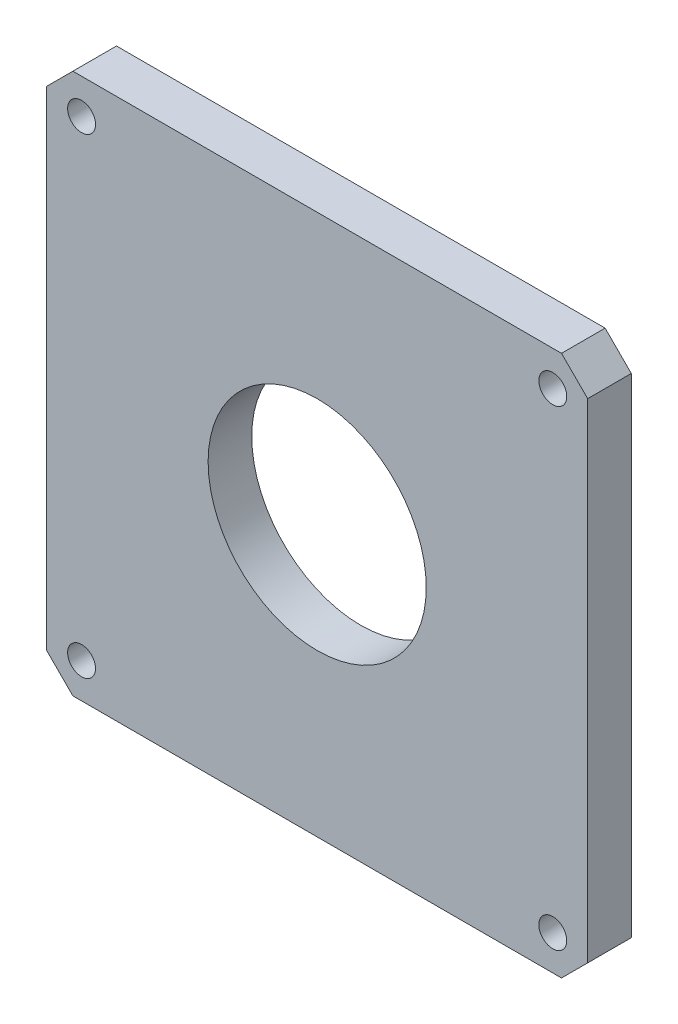
from build123d import *

# Parameters (mm, degrees)
SKETCH_1_W          = 62
SKETCH_1_H          = 62
SKETCH_1_R          = 12.5
EXTRUDE_1_DEPTH     = 5
CHAMFER_1_SIZE      = 3
SKETCH_2_R          = 1.6
CUT_EXTRUDE_1_DEPTH = 45.124822946


with BuildPart() as part:
    # ｽｹｯﾁ1 → ﾎﾞｽ - 押し出し1 (new body)
    with BuildSketch(Plane.XY):
        Rectangle(SKETCH_1_W, SKETCH_1_H)
        Circle(SKETCH_1_R, mode=Mode.SUBTRACT)
    extrude(amount=EXTRUDE_1_DEPTH)

    # 面取り1
    chamfer_1_edges = [part.edges().sort_by_distance(p)[0] for p in [
        (-31, 31, 2.5),
        (31, 31, 2.5),
        (31, -31, 2.5),
        (-31, -31, 2.5),
    ]]
    chamfer(chamfer_1_edges, length=CHAMFER_1_SIZE)

    # ｽｹｯﾁ2 → ｶｯﾄ - 押し出し1 (cut, through all)
    with BuildSketch(Plane.XY.offset(5)):
        with Locations((27, 27)):
            Circle(SKETCH_2_R)
        with Locations(Location((-27, 27, 0), (0, 0, 180))):
            Circle(SKETCH_2_R)
        with Locations(Location((27, -27, 0), (0, 0, 180))):
            Circle(SKETCH_2_R)
        with Locations((-27, -27)):
            Circle(SKETCH_2_R)
    extrude(amount=-CUT_EXTRUDE_1_DEPTH, mode=Mode.SUBTRACT)


solid = part.part
